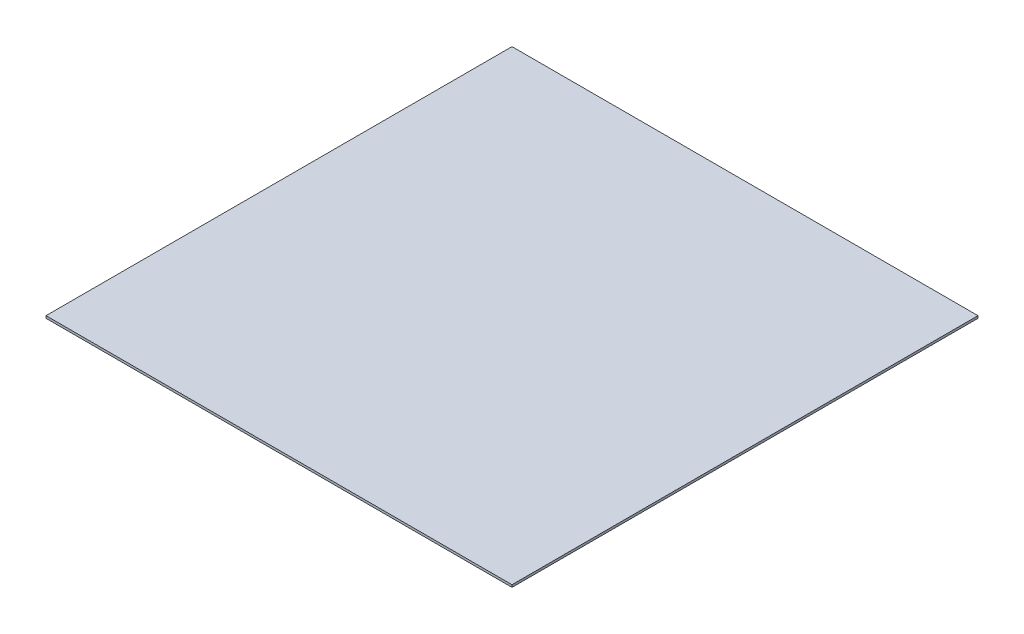
from build123d import *

# Parameters (mm, degrees)
SKETCH_1_W      = 400
SKETCH_1_H      = 400
EXTRUDE_1_DEPTH = 1


with BuildPart() as part:
    # 草图1 → 凸台-拉伸1 (new, symmetric)
    with BuildSketch(Plane(origin=(0, 0, 0), x_dir=(1, 0, 0), z_dir=(0, 1, 0))):
        Rectangle(SKETCH_1_W, SKETCH_1_H)
    extrude(amount=EXTRUDE_1_DEPTH, both=True)


solid = part.part
